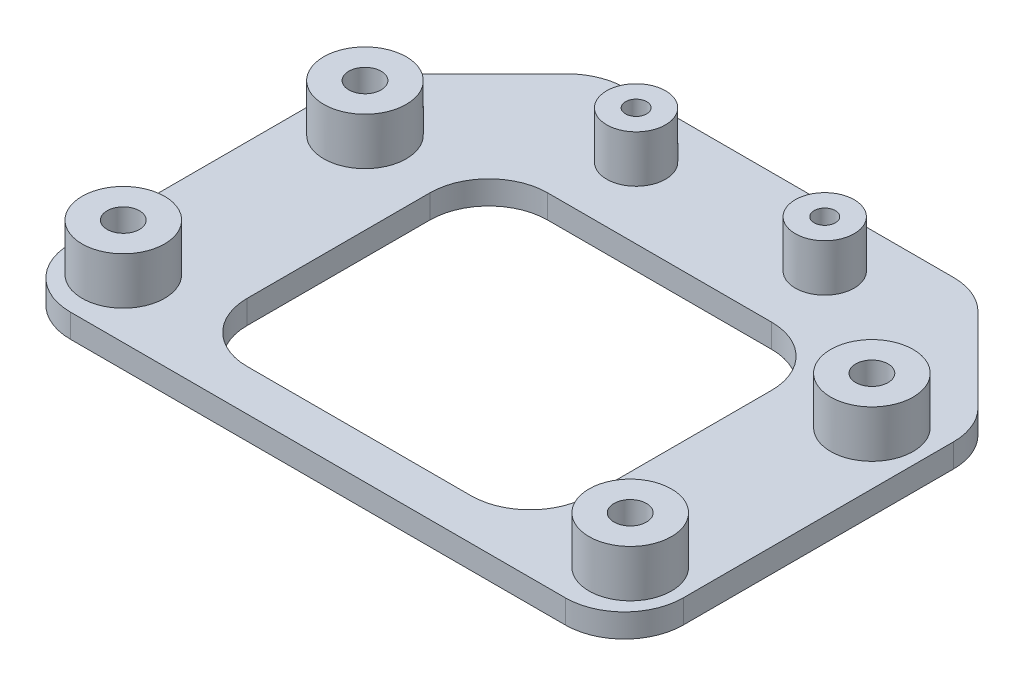
from build123d import *

# Parameters (mm, degrees)
SKETCH1_W           = 52
SKETCH1_H           = 40
BOSS_EXTRUDE1_DEPTH = 2
SKETCH2_R           = 0.9
SKETCH2_R_2         = 1.375
CUT_EXTRUDE1_DEPTH  = 33.86335345
BOSS_EXTRUDE2_START = 4
SKETCH3_R           = 3.5
SKETCH3_R_2         = 1.375
SKETCH3_R_3         = 2.5
SKETCH3_R_4         = 0.9
BOSS_EXTRUDE2_DEPTH = 4
SKETCH4_W           = 29
SKETCH4_H           = 25.5
CUT_EXTRUDE2_DEPTH  = 34.045423284
CHAMFER1_SIZE       = 10
FILLET1_R           = 5


with BuildPart() as part:
    # Sketch1 → Boss-Extrude1 (new body)
    with BuildSketch(Plane(origin=(0, 0, 0), x_dir=(1, 0, 0), z_dir=(0, 1, 0))):
        Rectangle(SKETCH1_W, SKETCH1_H)
    extrude(amount=BOSS_EXTRUDE1_DEPTH)

    # Sketch2 → Cut-Extrude1 (cut, through all)
    with BuildSketch(Plane(origin=(0, 2, 0), x_dir=(1, 0, 0), z_dir=(0, 1, 0))):
        with Locations(Location((8, 15, 0), (0, 0, 270))):
            Circle(SKETCH2_R)
        with Locations(Location((-8, 15, 0), (0, 0, 270))):
            Circle(SKETCH2_R)
        with Locations(Location((-21.5, 5.5, 0), (0, 0, 270))):
            Circle(SKETCH2_R_2)
        with Locations(Location((-21.5, -15, 0), (0, 0, 270))):
            Circle(SKETCH2_R_2)
        with Locations(Location((21.5, -15, 0), (0, 0, 270))):
            Circle(SKETCH2_R_2)
        with Locations(Location((21.5, 5.5, 0), (0, 0, 270))):
            Circle(SKETCH2_R_2)
    extrude(amount=-CUT_EXTRUDE1_DEPTH, mode=Mode.SUBTRACT)

    # Sketch3 → Boss-Extrude2 (add)
    # profile 1 of 6: a face of its own
    with BuildSketch(Plane(origin=(0, 2, 0), x_dir=(1, 0, 0), z_dir=(0, 1, 0)).offset(BOSS_EXTRUDE2_START)):
        with Locations(Location((-21.5, 5.5, 0), (0, 0, 90))):
            Circle(SKETCH3_R)
        with Locations(Location((-21.5, 5.5, 0), (0, 0, 270))):
            Circle(SKETCH3_R_2, mode=Mode.SUBTRACT)
    # profile 2 of 6: a face of its own
    with BuildSketch(Plane(origin=(0, 2, 0), x_dir=(1, 0, 0), z_dir=(0, 1, 0)).offset(BOSS_EXTRUDE2_START)):
        with Locations(Location((-21.5, -15, 0), (0, 0, 90))):
            Circle(SKETCH3_R)
        with Locations(Location((-21.5, -15, 0), (0, 0, 270))):
            Circle(SKETCH3_R_2, mode=Mode.SUBTRACT)
    # profile 3 of 6: a face of its own
    with BuildSketch(Plane(origin=(0, 2, 0), x_dir=(1, 0, 0), z_dir=(0, 1, 0)).offset(BOSS_EXTRUDE2_START)):
        with Locations(Location((21.5, -15, 0), (0, 0, 90))):
            Circle(SKETCH3_R)
        with Locations(Location((21.5, -15, 0), (0, 0, 270))):
            Circle(SKETCH3_R_2, mode=Mode.SUBTRACT)
    # profile 4 of 6: a face of its own
    with BuildSketch(Plane(origin=(0, 2, 0), x_dir=(1, 0, 0), z_dir=(0, 1, 0)).offset(BOSS_EXTRUDE2_START)):
        with Locations(Location((21.5, 5.5, 0), (0, 0, 90))):
            Circle(SKETCH3_R)
        with Locations(Location((21.5, 5.5, 0), (0, 0, 270))):
            Circle(SKETCH3_R_2, mode=Mode.SUBTRACT)
    # profile 5 of 6: a face of its own
    with BuildSketch(Plane(origin=(0, 2, 0), x_dir=(1, 0, 0), z_dir=(0, 1, 0)).offset(BOSS_EXTRUDE2_START)):
        with Locations(Location((8, 15, 0), (0, 0, 90))):
            Circle(SKETCH3_R_3)
        with Locations(Location((8, 15, 0), (0, 0, 270))):
            Circle(SKETCH3_R_4, mode=Mode.SUBTRACT)
    # profile 6 of 6: a face of its own
    with BuildSketch(Plane(origin=(0, 2, 0), x_dir=(1, 0, 0), z_dir=(0, 1, 0)).offset(BOSS_EXTRUDE2_START)):
        with Locations(Location((-8, 15, 0), (0, 0, 90))):
            Circle(SKETCH3_R_3)
        with Locations(Location((-8, 15, 0), (0, 0, 270))):
            Circle(SKETCH3_R_4, mode=Mode.SUBTRACT)
    extrude(amount=-BOSS_EXTRUDE2_DEPTH)

    # Sketch4 → Cut-Extrude2 (cut, through all)
    with BuildSketch(Plane(origin=(0, 2, 0), x_dir=(1, 0, 0), z_dir=(0, 1, 0))):
        with Locations((0, -3.75)):
            Rectangle(SKETCH4_W, SKETCH4_H)
    extrude(amount=-CUT_EXTRUDE2_DEPTH, mode=Mode.SUBTRACT)

    # Chamfer1
    chamfer1_edges = [part.edges().sort_by_distance(p)[0] for p in [
        (-26, 1, -20),
        (26, 1, -20),
    ]]
    chamfer(chamfer1_edges, length=CHAMFER1_SIZE)

    # Fillet1
    fillet1_edges = [part.edges().sort_by_distance(p)[0] for p in [
        (26, 1, 20),
        (-26, 1, 20),
        (14.5, 1, -9),
        (14.5, 1, 16.5),
        (-14.5, 1, 16.5),
        (-14.5, 1, -9),
        (-16, 1, -20),
        (16, 1, -20),
        (26, 1, -10),
        (-26, 1, -10),
    ]]
    fillet(fillet1_edges, radius=FILLET1_R)


solid = part.part
